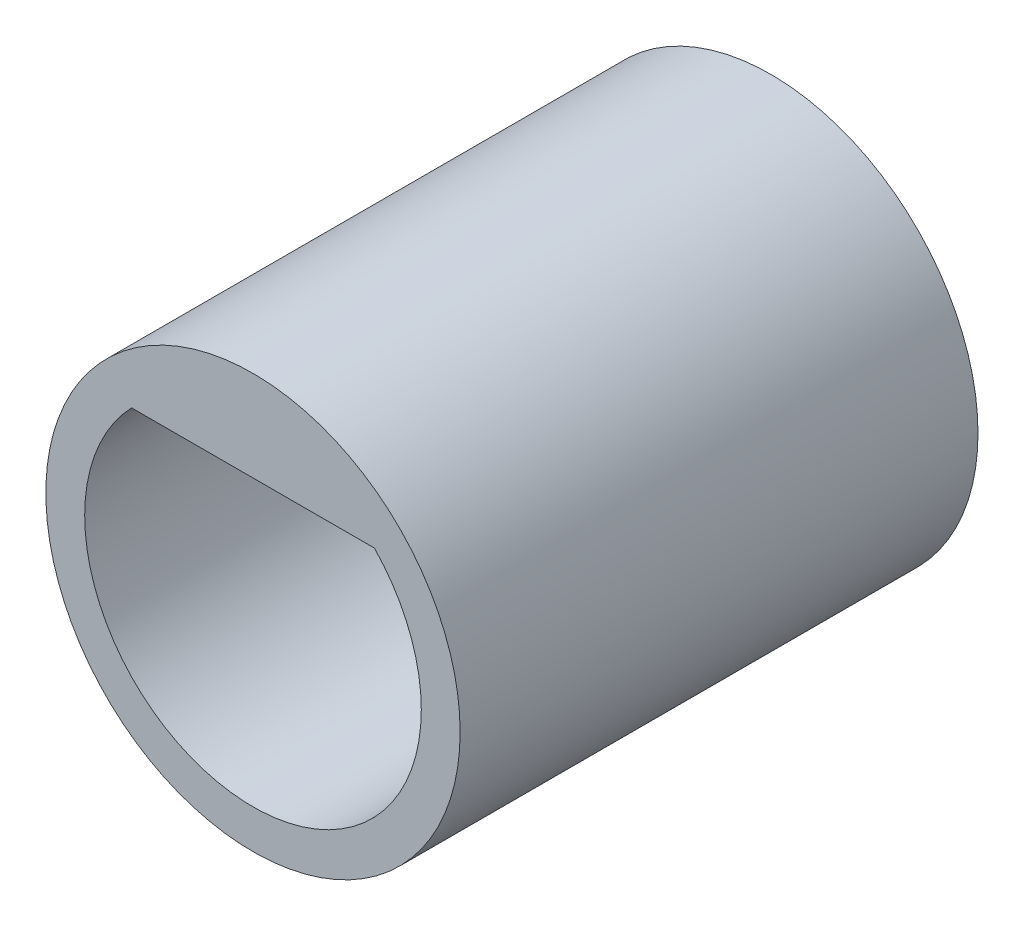
from build123d import *

# Parameters (mm, degrees)
SKETCH1_R           = 2
BOSS_EXTRUDE1_DEPTH = 5


with BuildPart() as part:
    # Sketch1 → Boss-Extrude1 (new body)
    with BuildSketch(Plane.XY):
        Circle(SKETCH1_R)
        with BuildLine():
            Line((-1.17260394, 1.125), (1.17260394, 1.125))
            ThreePointArc((1.17260394, 1.125), (0, -1.625), (-1.17260394, 1.125))
        make_face(mode=Mode.SUBTRACT)
    extrude(amount=BOSS_EXTRUDE1_DEPTH)


solid = part.part
